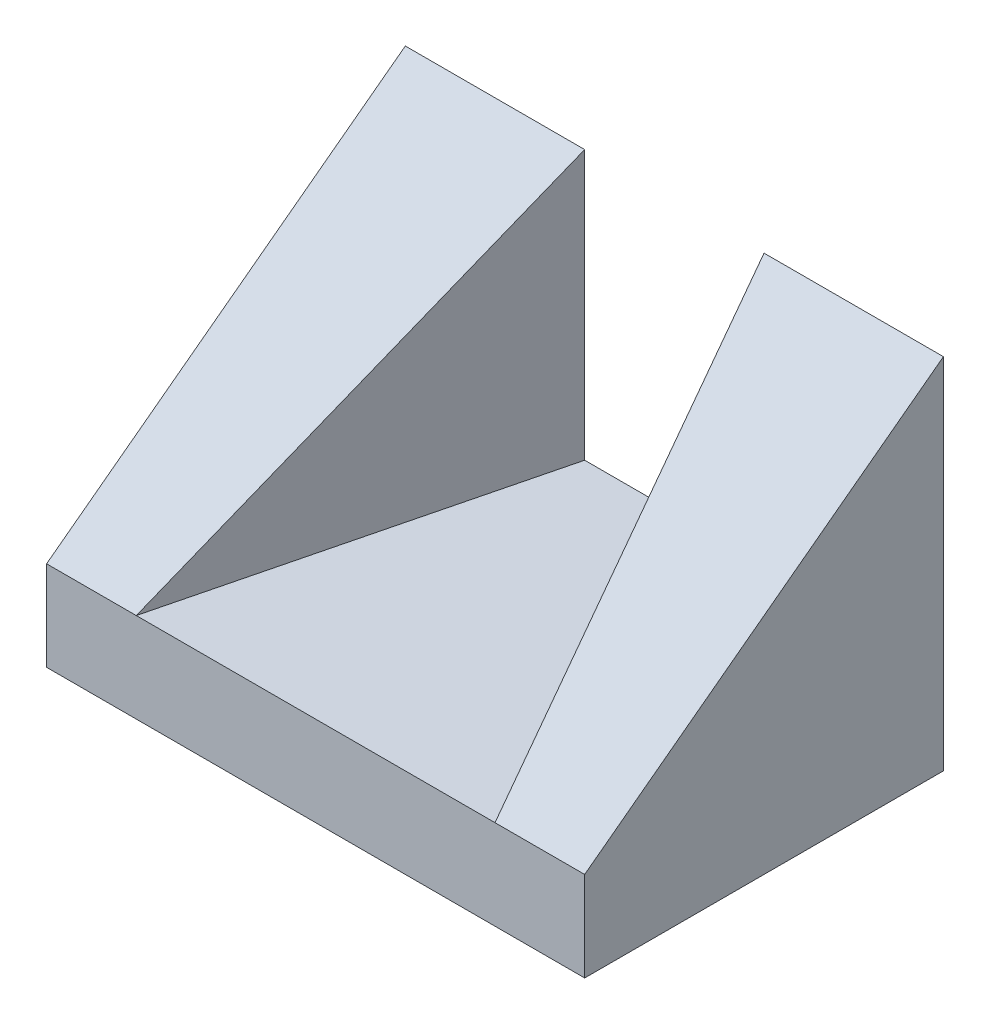
from build123d import *

# Parameters (mm, degrees)
BOSS_EXTRUDE1_DEPTH = 30
CUT_EXTRUDE1_DEPTH  = 30


with BuildPart() as part:
    # Sketch1 → Boss-Extrude1 (new, symmetric)
    with BuildSketch(Plane(origin=(0, 0, 0), x_dir=(0, 0, -1), z_dir=(1, 0, 0))):
        Polygon((0, 0), (0, -40), (-40, -40), (-40, -30), align=None)
    extrude(amount=BOSS_EXTRUDE1_DEPTH, both=True)

    # Sketch2 → Cut-Extrude1 (cut)
    with BuildSketch(Plane(origin=(0, 0, 0), x_dir=(1, 0, 0), z_dir=(0, 1, 0))):
        Polygon((-10, 0), (10, 0), (20, -40), (-20, -40), align=None)
    extrude(amount=-CUT_EXTRUDE1_DEPTH, mode=Mode.SUBTRACT)


solid = part.part
